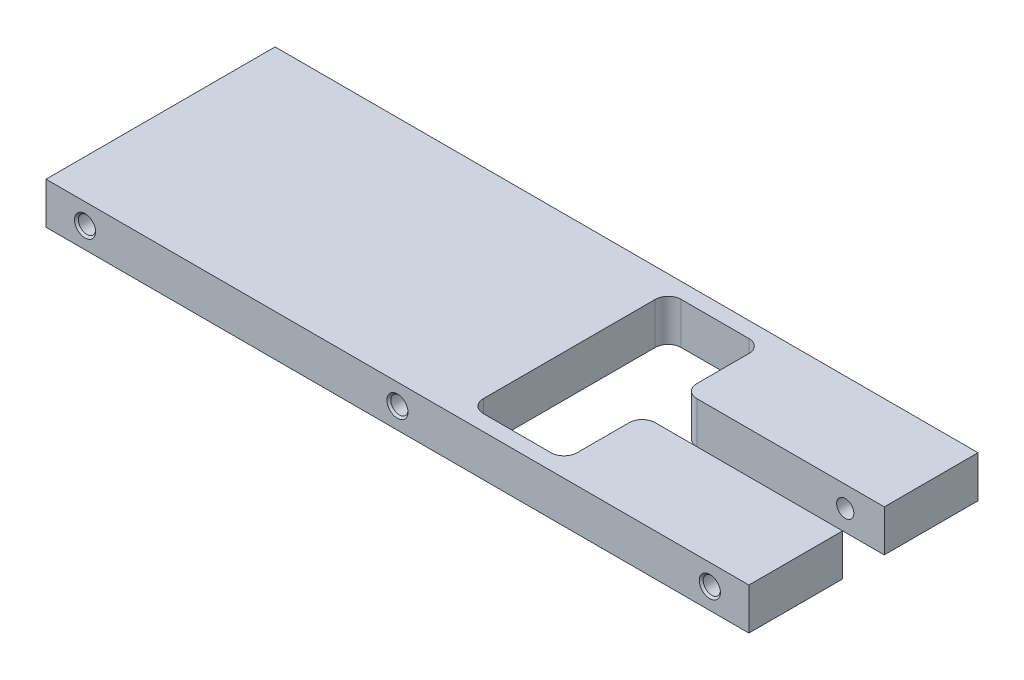
from build123d import *

# Parameters (mm, degrees)
SKETCH1_W                       = 135
SKETCH1_H                       = 44
BOSS_EXTRUDE1_DEPTH             = 8
CUT_EXTRUDE1_DEPTH              = 10
FILLET1_R                       = 2.5
FILLET2_R                       = 2.5
M4X0_7_TAPPED_HOLE1_D           = 3.3
M4X0_7_TAPPED_HOLE1_CSINK_D     = 4.05
M4X0_7_TAPPED_HOLE1_CSINK_ANGLE = 90


with BuildPart() as part:
    # Sketch1 → Boss-Extrude1 (new body)
    with BuildSketch(Plane(origin=(0, 0, 0), x_dir=(1, 0, 0), z_dir=(0, 1, 0))):
        with Locations((14, 14)):
            Rectangle(SKETCH1_W, SKETCH1_H)
    extrude(amount=BOSS_EXTRUDE1_DEPTH)

    # Sketch7 → Cut-Extrude1 (cut)
    with BuildSketch(Plane(origin=(0, 0, 0), x_dir=(1, 0, 0), z_dir=(0, 1, 0))):
        Polygon((81.5, 10), (81.5, 18), (43, 18), (43, 33), (25, 33), (25, -5), (43, -5), (43, 10), align=None)
    extrude(amount=CUT_EXTRUDE1_DEPTH, mode=Mode.SUBTRACT)

    # Fillet1
    fillet1_edges = [part.edges().sort_by_distance(p)[0] for p in [
        (43, 4, -33),
        (25, 4, -33),
        (25, 4, 5),
        (43, 4, 5),
    ]]
    fillet(fillet1_edges, radius=FILLET1_R)

    # Fillet2
    fillet2_edges = [part.edges().sort_by_distance(p)[0] for p in [
        (43, 4, -18),
        (43, 4, -10),
    ]]
    fillet(fillet2_edges, radius=FILLET2_R)

    # M4x0.7 Tapped Hole1 (through all)
    with Locations(Plane.XY.offset(8)):
        with Locations((-46, 4), (14, 4), (74, 4)):
            CounterSinkHole(M4X0_7_TAPPED_HOLE1_D / 2, M4X0_7_TAPPED_HOLE1_CSINK_D / 2, counter_sink_angle=M4X0_7_TAPPED_HOLE1_CSINK_ANGLE)


solid = part.part
